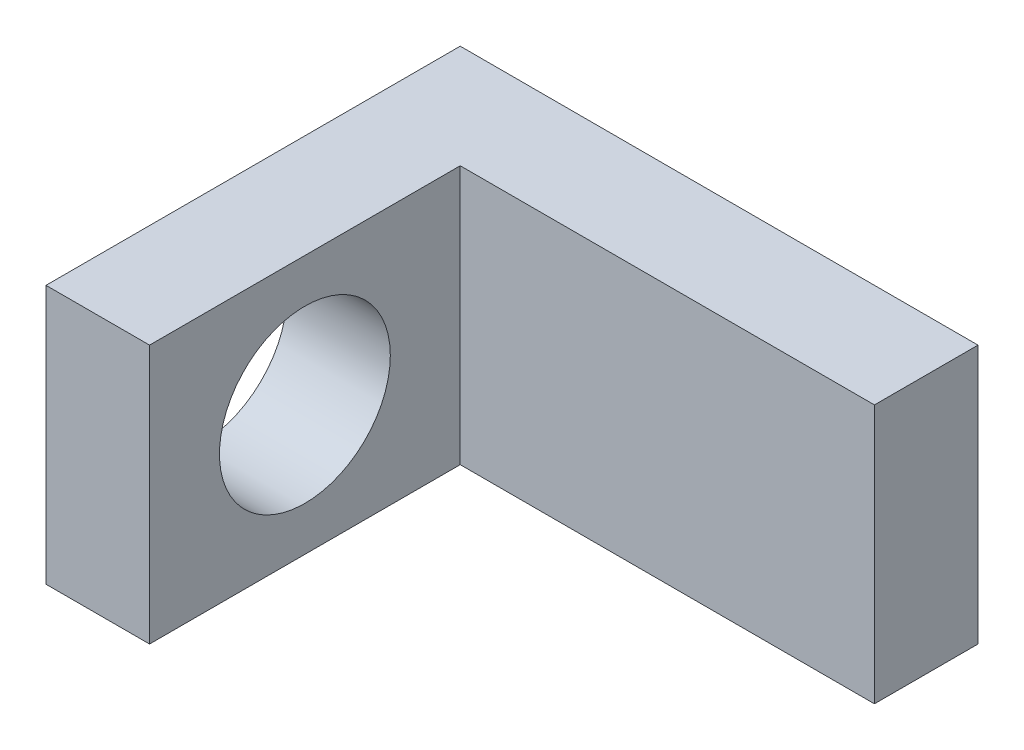
from build123d import *

# Parameters (mm, degrees)
BOSS_EXTRUDE1_DEPTH         = 5
TAP_DRILL_FOR_M4X0_7_TAP1_D = 3.3


with BuildPart() as part:
    # Sketch1 → Boss-Extrude1 (new body)
    with BuildSketch(Plane(origin=(0, 0, 0), x_dir=(1, 0, 0), z_dir=(0, 1, 0))):
        Polygon((0, 0), (0, -8), (2, -8), (2, -2), (10, -2), (10, 0), align=None)
    extrude(amount=BOSS_EXTRUDE1_DEPTH)

    # Tap Drill for M4x0.7 Tap1 (through all)
    with Locations(Plane(origin=(2, 0, 0), x_dir=(0, 0, -1), z_dir=(1, 0, 0))):
        with Locations((-5, 2.502260539)):
            Hole(TAP_DRILL_FOR_M4X0_7_TAP1_D / 2)


solid = part.part
